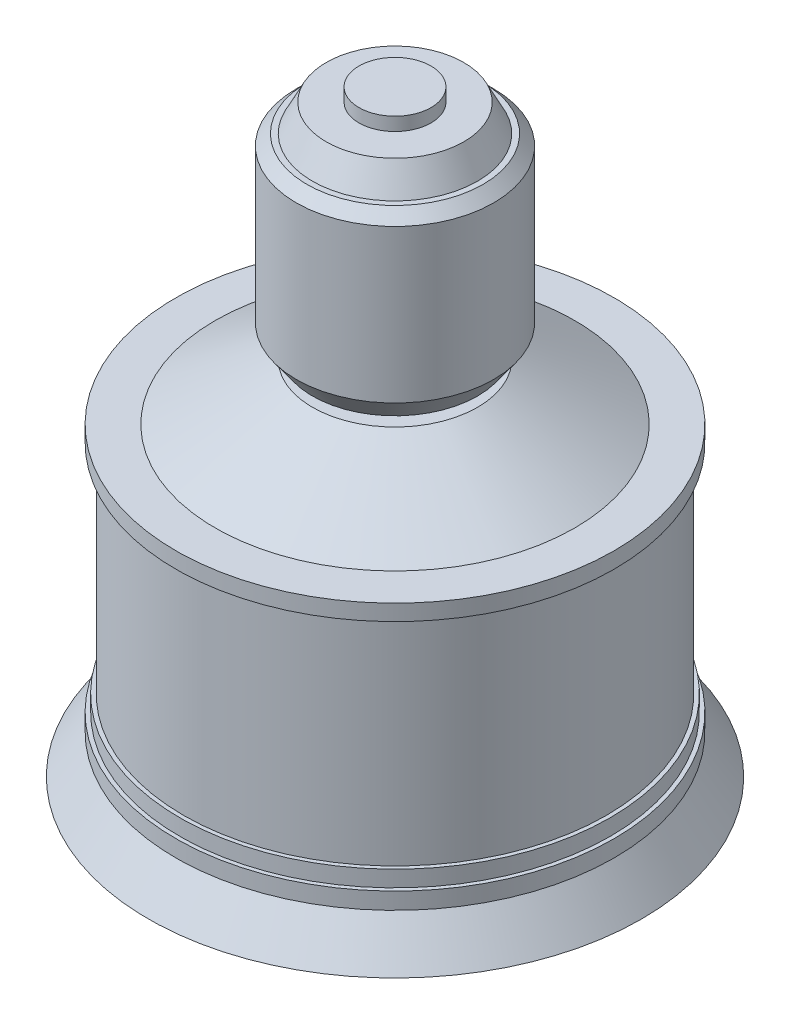
from build123d import *

# Parameters (mm, degrees)
SCALE_1_SCALE = 0.1


with BuildPart() as part:
    # 草图1 one side → 旋转6 (revolve)
    with BuildSketch(Plane.XY, mode=Mode.PRIVATE) as revolve_6_sk:
        Polygon((-188.810566164, -8.557887153), (126.189433836, -8.557887153), (126.189433836, 754.802017268), (80.146848974, 754.802017268), (80.146848974, 737.812396498), (38.326244001, 737.812396498), (20.683176277, 703.0661449), (13.608822902, 703.0661449), (0, 689.457321998), (0, 494.076683139), (20.683176277, 465.32501722), (71.652038589, 465.32501722), (71.652038589, 452.909525118), (20.683176277, 452.909525118), (-103.471744737, 381.442112847), (-153.810566164, 381.442112847), (-153.810566164, 361.011582025), (-143.810566164, 361.011582025), (-143.810566164, 83.57948853), (-148.810566164, 83.57948853), (-148.810566164, 62.91133749), (-153.810566164, 62.91133749), (-153.810566164, 41.54424733), align=None)
    revolve(revolve_6_sk.sketch.rotate(Axis((126.189433836, 41.54424733, 0), (0, 1, 0)), 180), axis=Axis((126.189433836, 41.54424733, 0), (0, 1, 0)))

    # 草图2 → 切除-旋转1 (revolve, cut)
    with BuildSketch(Plane.XY):
        Polygon((-176.273470249, -8.557887153), (-140.148471815, 41.54424733), (-140.148471815, 56.139540799), (-131.681675308, 56.139540799), (-131.681675308, 76.742078968), (-121.803746049, 76.742078968), (-121.803746049, 364.305826939), (126.189433836, 364.305826939), (126.189433836, -8.557887153), align=None)
    revolve(axis=Axis((126.189433836, 364.305826939, 0), (0, -1, 0)), mode=Mode.SUBTRACT)


with BuildPart() as part_1:
    # 缩放比例1: scaled about (126.189433836, 394.552183872, 0)
    add(part.part.scale(SCALE_1_SCALE).moved(Location((113.570490452, 355.096965485, 0))))


solid = part_1.part
